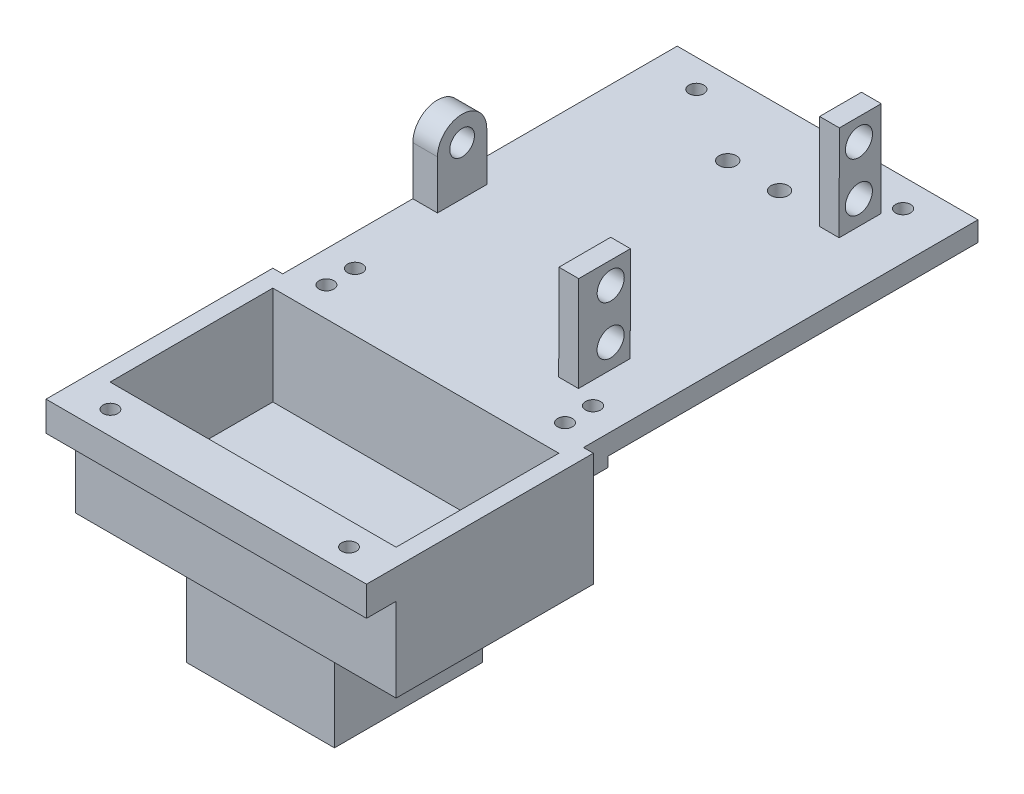
from build123d import *

# Parameters (mm, degrees)
SKETCH_1_W               = 60.99726579
SKETCH_1_H               = 80
EXTRUDE_1_DEPTH          = 1
SKETCH_2_R               = 1.524
CUT_EXTRUDE_1_DEPTH      = 1
SKETCH_3_W               = 1
SKETCH_3_H               = 21.992162459
EXTRUDE_2_DEPTH          = 22
SKETCH_7_W               = 7.5
SKETCH_7_H               = 19.330567091
SKETCH_7_R               = 2.75
EXTRUDE_3_DEPTH          = 3
SKETCH_7_H_2             = 19.330671724
EXTRUDE_3_2_DEPTH        = 3
SKETCH_8_R               = 2.5
EXTRUDE_4_DEPTH          = 5
SKETCH_12_W              = 2
SKETCH_12_H              = 21.992162459
EXTRUDE_5_DEPTH          = 22
CUT_EXTRUDE_3_DEPTH      = 72.341536493
CUT_EXTRUDE_3_DEPTH_BACK = 15
SKETCH_9_R               = 1.75
SKETCH_14_W              = 17.99726579
SKETCH_14_H              = 10.99608123
EXTRUDE_6_DEPTH          = 3
SKETCH_15_R              = 1.75
CUT_EXTRUDE_4_DEPTH      = 67.029179397
SKETCH_18_W              = 125.682596232
SKETCH_18_H              = 131.027051286
CUT_EXTRUDE_6_DEPTH      = 66.55792676
EXTRUDE_START            = 3
SKETCH_19_W              = 60.99726579
SKETCH_19_H              = 80
SKETCH_19_R              = 1.524
SKETCH_19_R_2            = 1.75
EXTRUDE_7_DEPTH          = 3
SKETCH_20_W              = 60.99726579
SKETCH_20_H              = 40
EXTRUDE_8_DEPTH          = 23
SKETCH_21_W              = 58
SKETCH_21_H              = 33
CUT_EXTRUDE_7_DEPTH      = 20
SKETCH_26_W              = 30
SKETCH_26_H              = 30
EXTRUDE_9_DEPTH          = 20
EXTRUDE_10_DEPTH         = 3
SKETCH_28_W              = 10.5
SKETCH_28_H              = 19.330671724
SKETCH_28_R              = 2.75
EXTRUDE_11_DEPTH         = 1
EXTRUDE_12_DEPTH         = 1
SKETCH_30_W              = 8.5
SKETCH_30_H              = 19.330567091
SKETCH_30_R              = 2.75
EXTRUDE_13_DEPTH         = 1
SKETCH_31_W              = 60.99726579
SKETCH_31_H              = 5
SKETCH_31_R              = 1.5
EXTRUDE_14_DEPTH         = 2
SKETCH_33_R              = 1.5
CUT_EXTRUDE_8_DEPTH      = 110.173112919
SKETCH_35_W              = 40
SKETCH_35_H              = 23
EXTRUDE_15_DEPTH         = 2
SKETCH_36_W              = 40
SKETCH_36_H              = 23
EXTRUDE_16_DEPTH         = 2
SKETCH_38_W              = 64.99726579
SKETCH_38_H              = 6
EXTRUDE_17_DEPTH         = 6
SKETCH_39_R              = 1.5
CUT_EXTRUDE_11_DEPTH     = 6


with BuildPart() as part:
    # 스케치1 → 보스-돌출1 (new body)
    with BuildSketch(Plane(origin=(0, 0, 0), x_dir=(1, 0, 0), z_dir=(0, 1, 0))):
        with Locations((0.001367105, -13.699085291)):
            Rectangle(SKETCH_1_W, SKETCH_1_H)
    extrude(amount=EXTRUDE_1_DEPTH)

    # 스케치2 → 컷-돌출1 (cut)
    with BuildSketch(Plane.XZ):
        with Locations(Location((-24.13, 45.395, 0), (0, 0, 270))):
            Circle(SKETCH_2_R)
        with Locations(Location((24.13, 45.395, 0), (0, 0, 270))):
            Circle(SKETCH_2_R)
        with Locations(Location((-20.955, -20.645, 0), (0, 0, 270))):
            Circle(SKETCH_2_R)
        with Locations(Location((20.955, -20.645, 0), (0, 0, 270))):
            Circle(SKETCH_2_R)
    extrude(amount=-CUT_EXTRUDE_1_DEPTH, mode=Mode.SUBTRACT)

    # 스케치3 → 보스-돌출2 (add)
    with BuildSketch(Plane.XZ):
        with Locations((-11.49726579, -15.30483348)):
            Rectangle(SKETCH_3_W, SKETCH_3_H)
        with Locations((11.5, -15.30483348)):
            Rectangle(SKETCH_3_W, SKETCH_3_H)
    extrude(amount=EXTRUDE_2_DEPTH)

    # 스케치8 → 보스-돌출4 (add)
    with BuildSketch(Plane.ZY.offset(30.49726579)):
        with BuildLine():
            Line((17.314820169, 10.855722027), (17.314820169, 1))
            Line((17.314820169, 1), (27.314820169, 1))
            Line((27.314820169, 1), (27.314820169, 10.855722027))
            ThreePointArc((27.314820169, 10.855722027), (22.314820169, 15.855722027), (17.314820169, 10.855722027))
        make_face()
        with Locations((22.314820169, 10.855722027)):
            Circle(SKETCH_8_R, mode=Mode.SUBTRACT)
    extrude(amount=-EXTRUDE_4_DEPTH)

    # 스케치12 → 보스-돌출5 (add)
    with BuildSketch(Plane.XZ):
        with Locations((-9.99726579, -15.30483348)):
            Rectangle(SKETCH_12_W, SKETCH_12_H)
        with Locations((10, -15.30483348)):
            Rectangle(SKETCH_12_W, SKETCH_12_H)
    extrude(amount=EXTRUDE_5_DEPTH)

    # 스케치9 → 컷-돌출3 (cut, two sides: drawn at the far end of the back side and taken through both)
    with BuildSketch(Plane.ZY.offset(-11).offset(-CUT_EXTRUDE_3_DEPTH_BACK)):
        with Locations(Location((-22.606276953, -2.5, 0), (0, 0, 180))):
            Circle(SKETCH_9_R)
        with Locations(Location((-22.606276953, -19.5, 0), (0, 0, 180))):
            Circle(SKETCH_9_R)
    extrude(amount=CUT_EXTRUDE_3_DEPTH + CUT_EXTRUDE_3_DEPTH_BACK, mode=Mode.SUBTRACT)

    # 스케치14 → 보스-돌출6 (add)
    with BuildSketch(Plane.XZ):
        with Locations((0.001367105, -9.806792865)):
            Rectangle(SKETCH_14_W, SKETCH_14_H)
    extrude(amount=EXTRUDE_6_DEPTH)

    # 스케치15 → 컷-돌출4 (cut, through all)
    with BuildSketch(Plane.XZ.offset(3)):
        with Locations(Location((-5.258745872, -11.300890987, 0), (0, 0, 270))):
            Circle(SKETCH_15_R)
        with Locations(Location((5.258745872, -11.300890987, 0), (0, 0, 270))):
            Circle(SKETCH_15_R)
    extrude(amount=-CUT_EXTRUDE_4_DEPTH, mode=Mode.SUBTRACT)

    # 스케치18 → 컷-돌출6 (cut, through all)
    with BuildSketch(Plane.XZ):
        with Locations((10.227533259, 5.024212254)):
            Rectangle(SKETCH_18_W, SKETCH_18_H)
    extrude(amount=CUT_EXTRUDE_6_DEPTH, mode=Mode.SUBTRACT)

    # 스케치19 → 보스-돌출7 (add)
    with BuildSketch(Plane.XZ.offset(EXTRUDE_START)):
        with Locations((0.001367105, 13.699085291)):
            Rectangle(SKETCH_19_W, SKETCH_19_H)
        with Locations(Location((-24.13, 45.395, 0), (0, 0, 270))):
            Circle(SKETCH_19_R, mode=Mode.SUBTRACT)
        with Locations(Location((24.13, 45.395, 0), (0, 0, 270))):
            Circle(SKETCH_19_R, mode=Mode.SUBTRACT)
        with Locations(Location((-5.258745872, -11.300890987, 0), (0, 0, 270))):
            Circle(SKETCH_19_R_2, mode=Mode.SUBTRACT)
        with Locations(Location((5.258745872, -11.300890987, 0), (0, 0, 270))):
            Circle(SKETCH_19_R_2, mode=Mode.SUBTRACT)
        with Locations(Location((-20.955, -20.645, 0), (0, 0, 270))):
            Circle(SKETCH_19_R, mode=Mode.SUBTRACT)
        with Locations(Location((20.955, -20.645, 0), (0, 0, 270))):
            Circle(SKETCH_19_R, mode=Mode.SUBTRACT)
    extrude(amount=-EXTRUDE_7_DEPTH)

    # 스케치20 → 보스-돌출8 (add)
    with BuildSketch(Plane(origin=(0, 1, 0), x_dir=(1, 0, 0), z_dir=(0, 1, 0))):
        with Locations((0.001367105, -73.699085291)):
            Rectangle(SKETCH_20_W, SKETCH_20_H)
    extrude(amount=-EXTRUDE_8_DEPTH)

    # 스케치21 → 컷-돌출7 (cut)
    with BuildSketch(Plane(origin=(0, 1, 0), x_dir=(1, 0, 0), z_dir=(0, 1, 0))):
        with Locations((0.001367105, -73.699085291)):
            Rectangle(SKETCH_21_W, SKETCH_21_H)
    extrude(amount=-CUT_EXTRUDE_7_DEPTH, mode=Mode.SUBTRACT)



with BuildPart() as body_2:
    # 스케치7 → 보스-돌출3 (new body)
    with BuildSketch(Plane(origin=(19.618416861, -0.051361028, -0.014963481), x_dir=(0.0007627207868309801, -1.996803493320823e-06, 0.9999997091264647), z_dir=(-0.9999962821814526, 0.002617990887417953, 0.0007627234006428938))):
        with Locations((-12.757304863, 10.745128864)):
            Rectangle(SKETCH_7_W, SKETCH_7_H)
        with Locations(Location((-12.998254061, 15.951338675, 0), (0, 0, 270))):
            Circle(SKETCH_7_R, mode=Mode.SUBTRACT)
        with Locations(Location((-12.998234093, 5.951338675, 0), (0, 0, 270))):
            Circle(SKETCH_7_R, mode=Mode.SUBTRACT)
    extrude(amount=EXTRUDE_3_DEPTH)

    # 스케치29 → 보스-돌출12 (add)
    with BuildSketch(Plane(origin=(-0.012590465, 3.2962e-05, -16.507300061), x_dir=(-0.9999997091284585, -1.523003974434168e-09, 0.0007627207868294601), z_dir=(-0.0007627207868309806, 1.996803493141394e-06, -0.9999997091264647))):
        Polygon((-19.671856873, 20.358981407), (-19.621249595, 1.02848056), (-16.621259875, 1.036334538), (-16.671867153, 20.366835384), align=None)
    extrude(amount=EXTRUDE_12_DEPTH)

    # 스케치30 → 보스-돌출13 (add)
    with BuildSketch(Plane(origin=(16.618428015, -0.043507055, -0.012675311), x_dir=(0.0007627207868311324, -1.996803493321271e-06, 0.9999997091264647), z_dir=(-0.9999962821814526, 0.002617990887418022, 0.0007627234006430462))):
        with Locations((-13.257304863, 10.745128864)):
            Rectangle(SKETCH_30_W, SKETCH_30_H)
        with Locations(Location((-12.998254061, 15.951338675, 0), (0, 0, 270))):
            Circle(SKETCH_30_R, mode=Mode.SUBTRACT)
        with Locations(Location((-12.998234093, 5.951338675, 0), (0, 0, 270))):
            Circle(SKETCH_30_R, mode=Mode.SUBTRACT)
    extrude(amount=EXTRUDE_13_DEPTH)


with BuildPart() as body_3:
    # 스케치7 → Extrude 3 2 (new body)
    with BuildSketch(Plane(origin=(19.618416861, -0.051361028, -0.014963481), x_dir=(0.0007627207868309801, -1.996803493320823e-06, 0.9999997091264647), z_dir=(-0.9999962821814526, 0.002617990887417953, 0.0007627234006428938))):
        with Locations((37.142697347, 10.74518118)):
            Rectangle(SKETCH_7_W, SKETCH_7_H_2)
        with Locations(Location((37.383594441, 15.951439278, 0), (0, 0, 270))):
            Circle(SKETCH_7_R, mode=Mode.SUBTRACT)
        with Locations(Location((37.383614409, 5.951439278, 0), (0, 0, 270))):
            Circle(SKETCH_7_R, mode=Mode.SUBTRACT)
    extrude(amount=EXTRUDE_3_2_DEPTH)

    # 스케치27 → 보스-돌출10 (add)
    with BuildSketch(Plane(origin=(0.03118971, -8.1655e-05, 40.892685452), x_dir=(0.9999997091284585, 1.5230039745710364e-09, -0.0007627207868294599), z_dir=(0.0007627207868309804, -1.9968034933208416e-06, 0.9999997091264647))):
        Polygon((19.621249595, 1.02848056), (19.671857146, 20.359086039), (16.671867427, 20.366940016), (16.621259875, 1.036334538), align=None)
    extrude(amount=EXTRUDE_10_DEPTH)

    # 스케치28 → 보스-돌출11 (add)
    with BuildSketch(Plane(origin=(16.618428015, -0.043507055, -0.012675311), x_dir=(0.00076272078683067, -1.996803493320029e-06, 0.9999997091264647), z_dir=(-0.9999962821814526, 0.002617990887417981, 0.0007627234006425838))):
        with Locations((38.642697347, 10.74518118)):
            Rectangle(SKETCH_28_W, SKETCH_28_H)
        with Locations(Location((37.383594441, 15.951439278, 0), (0, 0, 270))):
            Circle(SKETCH_28_R, mode=Mode.SUBTRACT)
        with Locations(Location((37.383614409, 5.951439278, 0), (0, 0, 270))):
            Circle(SKETCH_28_R, mode=Mode.SUBTRACT)
    extrude(amount=EXTRUDE_11_DEPTH)


with BuildPart() as body_4:
    # 스케치24 → 회전1 (revolve)
    with BuildSketch(Plane(origin=(0, 0, 0), x_dir=(0, 0, -1), z_dir=(1, 0, 0))):
        with BuildLine():
            Line((-73.699085291, -52), (-73.699085291, -42))
            Line((-73.699085291, -42), (-63.699085291, -42))
            ThreePointArc((-63.699085291, -42), (-66.628017479, -49.071067812), (-73.699085291, -52))
        make_face()
    revolve(axis=Axis((0, -22, 73.699085291), (0, -1, 0)))


with BuildPart() as part_1:
    add(part.part)

    add(body_4.part)  # 보스-돌출9 merges body 4
    # 스케치26 → 보스-돌출9 (add)
    with BuildSketch(Plane.XZ.offset(22)):
        with Locations((0, 73.699085291)):
            Rectangle(SKETCH_26_W, SKETCH_26_H)
    extrude(amount=EXTRUDE_9_DEPTH)

    # 스케치31 → 보스-돌출14 (add)
    with BuildSketch(Plane.XZ.offset(3)):
        with Locations((0.001367105, 51.199085291)):
            Rectangle(SKETCH_31_W, SKETCH_31_H)
        with Locations(Location((-24.13, 51.199085291, 0), (0, 0, 270))):
            Circle(SKETCH_31_R, mode=Mode.SUBTRACT)
        with Locations(Location((24.250641605, 51.199085291, 0), (0, 0, 270))):
            Circle(SKETCH_31_R, mode=Mode.SUBTRACT)
    extrude(amount=EXTRUDE_14_DEPTH)

    # 스케치33 → 컷-돌출8 (cut, through all)
    with BuildSketch(Plane.XZ.offset(5)):
        with Locations(Location((24.250641605, 51.199085291, 0), (0, 0, 270))):
            Circle(SKETCH_33_R)
        with Locations(Location((-24.13, 51.199085291, 0), (0, 0, 270))):
            Circle(SKETCH_33_R)
    extrude(amount=-CUT_EXTRUDE_8_DEPTH, mode=Mode.SUBTRACT)

    # 스케치35 → 보스-돌출15 (add)
    with BuildSketch(Plane.ZY.offset(30.49726579)):
        with Locations((73.699085291, -10.5)):
            Rectangle(SKETCH_35_W, SKETCH_35_H)
    extrude(amount=EXTRUDE_15_DEPTH)

    # 스케치36 → 보스-돌출16 (add)
    with BuildSketch(Plane(origin=(30.5, 0, 0), x_dir=(0, 0, -1), z_dir=(1, 0, 0))):
        with Locations((-73.699085291, -10.5)):
            Rectangle(SKETCH_36_W, SKETCH_36_H)
    extrude(amount=EXTRUDE_16_DEPTH)

    # 스케치38 → 보스-돌출17 (add)
    with BuildSketch(Plane.XY.offset(93.699085291)):
        with Locations((0.001367105, -2)):
            Rectangle(SKETCH_38_W, SKETCH_38_H)
    extrude(amount=EXTRUDE_17_DEPTH)

    # 스케치39 → 컷-돌출11 (cut)
    with BuildSketch(Plane(origin=(0, 1, 0), x_dir=(1, 0, 0), z_dir=(0, 1, 0))):
        with Locations(Location((-24.188953697, -94.949085291, 0), (0, 0, 270))):
            Circle(SKETCH_39_R)
        with Locations(Location((24.191687908, -94.949085291, 0), (0, 0, 270))):
            Circle(SKETCH_39_R)
    extrude(amount=-CUT_EXTRUDE_11_DEPTH, mode=Mode.SUBTRACT)


solid = Compound([body_2.part, body_3.part, part_1.part])
